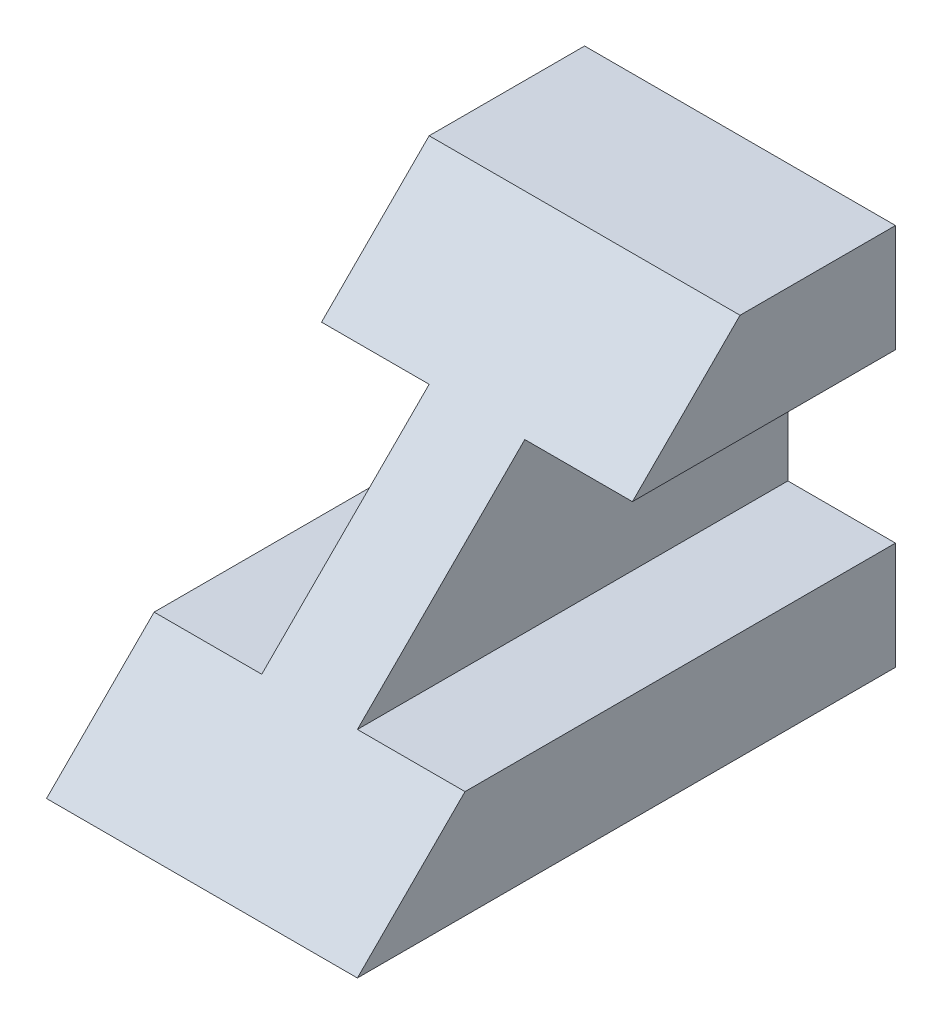
from build123d import *

# Parameters (mm, degrees)
EXTRUDE_1_DEPTH     = 13
SKETCH_2_W          = 9
SKETCH_2_H          = 14
CUT_EXTRUDE_1_DEPTH = 57.727418415


with BuildPart() as part:
    # 草图1 → 凸台-拉伸1 (new, symmetric)
    with BuildSketch(Plane(origin=(0, 0, 0), x_dir=(0, 0, -1), z_dir=(1, 0, 0))):
        Polygon((0, 0), (45, 0), (45, 32), (32, 32), align=None)
    extrude(amount=EXTRUDE_1_DEPTH, both=True)

    # 草图2 → 切除-拉伸1 (cut, through all)
    with BuildSketch(Plane(origin=(0, 0, -45), x_dir=(-1, 0, 0), z_dir=(0, 0, -1))):
        with Locations((-8.5, 16)):
            Rectangle(SKETCH_2_W, SKETCH_2_H)
        with Locations((8.5, 16)):
            Rectangle(SKETCH_2_W, SKETCH_2_H)
    extrude(amount=-CUT_EXTRUDE_1_DEPTH, mode=Mode.SUBTRACT)


solid = part.part
